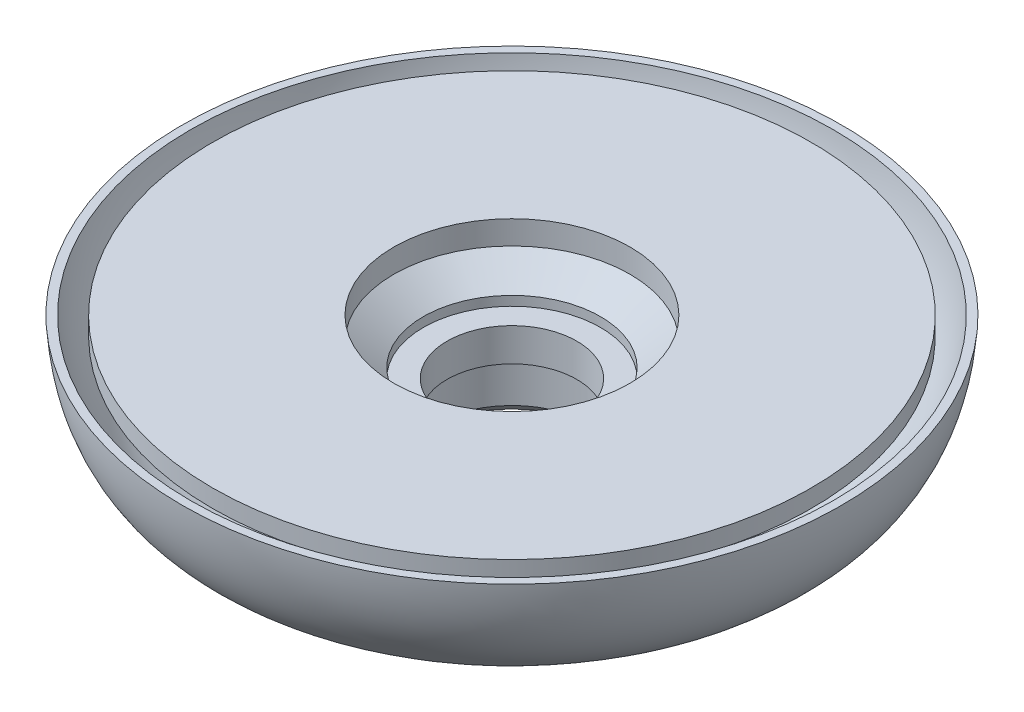
from build123d import *


with BuildPart() as part:
    # Sketch1 → Revolve1 (revolve)
    with BuildSketch(Plane.XY):
        with BuildLine():
            Line((-21.8, 5.207082814), (-8.6, 5.207082814))
            Line((-8.6, 5.207082814), (-8.6, 3.487716788))
            Line((-8.6, 3.487716788), (-6.45, 1.893195372))
            Line((-6.45, 1.893195372), (-6.45, 1.207082814))
            Line((-6.45, 1.207082814), (-4.725, 1.207082814))
            Line((-4.725, 1.207082814), (-4.725, -1.207082814))
            Line((-4.725, -1.207082814), (-5.792193517, -1.207082814))
            Line((-5.792193517, -1.207082814), (-5.792193517, -4.58565461))
            Line((-5.792193517, -4.58565461), (-7.039346549, -5.692917186))
            Line((-7.039346549, -5.692917186), (-8.009354463, -5.692917186))
            Line((-8.009354463, -5.692917186), (-8.009354463, -4.922332057))
            Line((-8.009354463, -4.922332057), (-7.484167863, -4.512624738))
            Line((-7.484167863, -4.512624738), (-13.491490452, -4.512624738))
            add(Edge.make_bspline(
                [(-24, 5.207082814), (-23.362064214, -4.252005312), (-13.491490452, -4.512624738)],
                knots=[0, 0, 0, 1, 1, 1], degree=2))
            Line((-24, 5.207082814), (-23.4, 5.207082814))
            add(Edge.make_bspline(
                [(-12.616940425, -3.912624738), (-22.084892945, -3.918102421), (-23.4, 5.207082814)],
                knots=[0, 0, 0, 1, 1, 1], degree=2))
            Line((-12.616940425, -3.912624738), (-11, -3.912624738))
            Line((-11, -3.912624738), (-11, 3.907082814))
            Line((-11, 3.907082814), (-21.8, 3.907082814))
            Line((-21.8, 3.907082814), (-21.8, 5.207082814))
        make_face()
    revolve(axis=Axis((0, 24.52235385, 0), (0, -1, 0)))


solid = part.part
